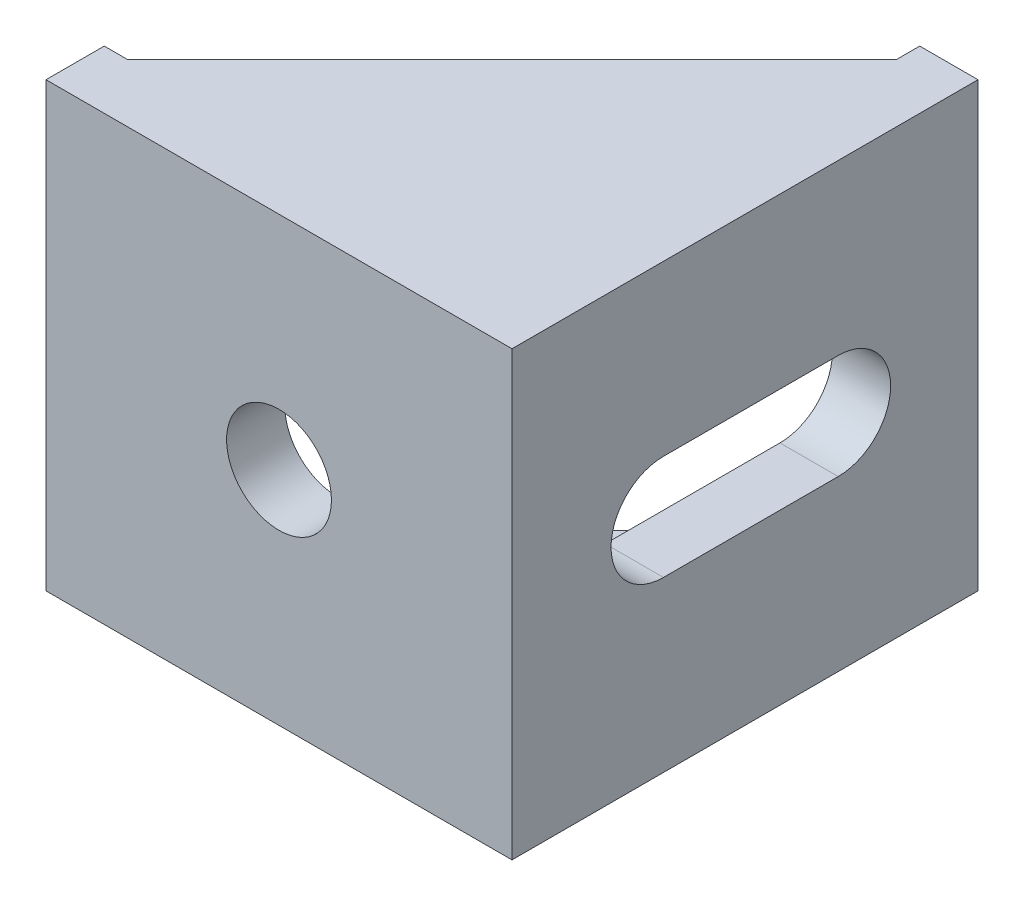
from build123d import *

# Parameters (mm, degrees)
EXTRUDE_THIN1_DEPTH = 19
CUT_EXTRUDE1_DEPTH  = 60.674114991
SKETCH3_R           = 4.5
CUT_EXTRUDE2_DEPTH  = 60.674114991
BOSS_EXTRUDE1_DEPTH = 3


with BuildPart() as part:
    # Sketch1 → Extrude-Thin1 (new, symmetric)
    with BuildSketch(Plane(origin=(0, 0, 0), x_dir=(1, 0, 0), z_dir=(0, 1, 0))):
        Polygon((-40, 0), (0, 0), (0, 40), (-5, 40), (-5, 5), (-40, 5), align=None)
    extrude(amount=EXTRUDE_THIN1_DEPTH, both=True)

    # Sketch2 → Cut-Extrude1 (cut, through all)
    with BuildSketch(Plane(origin=(0, 0, 0), x_dir=(0, 0, -1), z_dir=(1, 0, 0))):
        with BuildLine():
            Line((13, 4.5), (28, 4.5))
            ThreePointArc((28, 4.5), (32.5, 0), (28, -4.5))
            Line((28, -4.5), (13, -4.5))
            ThreePointArc((13, -4.5), (8.5, 0), (13, 4.5))
        make_face()
    extrude(amount=-CUT_EXTRUDE1_DEPTH, mode=Mode.SUBTRACT)

    # Sketch3 → Cut-Extrude2 (cut, through all)
    with BuildSketch(Plane.XY):
        with Locations((-20, 0)):
            Circle(SKETCH3_R)
    extrude(amount=-CUT_EXTRUDE2_DEPTH, mode=Mode.SUBTRACT)

    # Sketch4 → Boss-Extrude1 (add)
    with BuildSketch(Plane(origin=(0, 19, 0), x_dir=(1, 0, 0), z_dir=(0, 1, 0))):
        Polygon((-38, 5), (-5, 38), (-5, 5), align=None)
    boss_extrude1 = extrude(amount=-BOSS_EXTRUDE1_DEPTH)

    # Mirror1: Boss-Extrude1 across plane
    add(boss_extrude1.mirror(Plane.ZX))


solid = part.part
